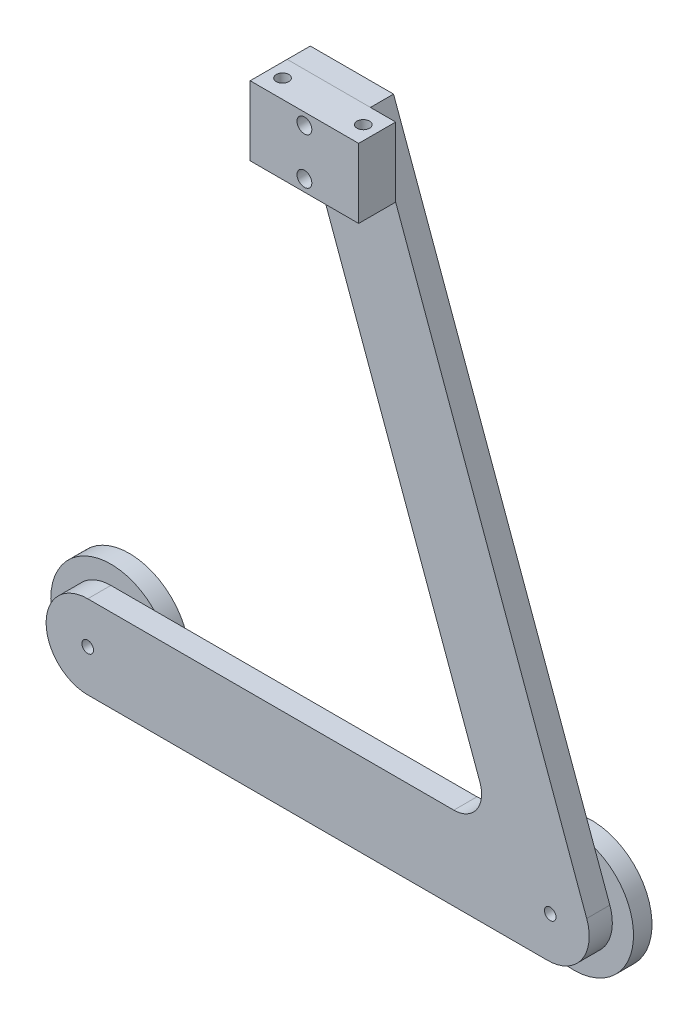
from build123d import *

# Parameters (mm, degrees)
SKETCH_1_R          = 1.25
EXTRUDE_1_DEPTH     = 5
SKETCH_2_W          = 23.459553514
SKETCH_2_H          = 15
EXTRUDE_2_DEPTH     = 8
SKETCH_3_R          = 1.6
CUT_EXTRUDE_1_DEPTH = 157.667782704
SKETCH_4_R          = 1.35
CUT_EXTRUDE_2_DEPTH = 160.025582655
SKETCH_6_R          = 3
SKETCH_6_R_2        = 1.25
EXTRUDE_3_DEPTH     = 5
EXTRUDE_3_2_DEPTH   = 5
SKETCH_7_R          = 13
SKETCH_7_R_2        = 3
EXTRUDE_4_DEPTH     = 4
EXTRUDE_4_2_DEPTH   = 4


with BuildPart() as part:
    # ｽｹｯﾁ1 → ﾎﾞｽ - 押し出し1 (new body)
    with BuildSketch(Plane.XY):
        with BuildLine():
            Line((-44.607087957, 122.55696691), (-2.930732316, 8.05212086))
            ThreePointArc((-2.930732316, 8.05212086), (-3.653975775, 2.558541382), (-8.56888804, 0))
            Line((-8.56888804, 0), (-87.724267892, 0))
            ThreePointArc((-87.724267892, 0), (-94.088228922, -2.636038969), (-96.724267892, -9))
            ThreePointArc((-96.724267892, -9), (-94.088228922, -15.363961031), (-87.724267892, -18))
            Line((-87.724267892, -18), (11.698132156, -18))
            ThreePointArc((11.698132156, -18), (19.070500555, -14.162187927), (20.155365743, -5.92181871))
            Line((20.155365743, -5.92181871), (-26.607087957, 122.55696691))
            Line((-26.607087957, 122.55696691), (-44.607087957, 122.55696691))
        make_face()
        with Locations((12.275732108, -9)):
            Circle(SKETCH_1_R, mode=Mode.SUBTRACT)
        with Locations((-87.724267892, -9)):
            Circle(SKETCH_1_R, mode=Mode.SUBTRACT)
    extrude(amount=EXTRUDE_1_DEPTH)


with BuildPart() as body_2:
    # ｽｹｯﾁ2 → ﾎﾞｽ - 押し出し2 (new body)
    with BuildSketch(Plane.XY.offset(5)):
        with Locations((-32.8773112, 115.05696691)):
            Rectangle(SKETCH_2_W, SKETCH_2_H)
    extrude(amount=EXTRUDE_2_DEPTH)


with BuildPart() as cut_extrude_1_tool:
    # ｽｹｯﾁ3 → ｶｯﾄ - 押し出し1 (new, through all)
    with BuildSketch(Plane.XY.offset(13)):
        with Locations((-32.8773112, 120.05696691)):
            Circle(SKETCH_3_R)
        with Locations((-32.8773112, 110.05696691)):
            Circle(SKETCH_3_R)
    extrude(amount=-CUT_EXTRUDE_1_DEPTH)


with BuildPart() as part_1:
    add(part.part)

    # ｶｯﾄ - 押し出し1: cut by cut_extrude_1_tool
    add(cut_extrude_1_tool.part, mode=Mode.SUBTRACT)


with BuildPart() as body_2_1:
    add(body_2.part)

    # ｶｯﾄ - 押し出し1: cut by cut_extrude_1_tool
    add(cut_extrude_1_tool.part, mode=Mode.SUBTRACT)

    # ｽｹｯﾁ4 → ｶｯﾄ - 押し出し2 (cut, through all)
    with BuildSketch(Plane.XZ.offset(-107.55696691)):
        with Locations(Location((-24.147534443, 9, 0), (0, 0, 270))):
            Circle(SKETCH_4_R)
        with Locations(Location((-41.607087957, 9, 0), (0, 0, 90))):
            Circle(SKETCH_4_R)
    extrude(amount=-CUT_EXTRUDE_2_DEPTH, mode=Mode.SUBTRACT)


with BuildPart() as body_3:
    # ｽｹｯﾁ6 → ﾎﾞｽ - 押し出し3 (new body)
    with BuildSketch(Plane(origin=(0, 0, 0), x_dir=(-1, 0, 0), z_dir=(0, 0, -1))):
        with Locations((-12.275732108, -9)):
            Circle(SKETCH_6_R)
        with Locations((-12.275732108, -9)):
            Circle(SKETCH_6_R_2, mode=Mode.SUBTRACT)
    extrude(amount=EXTRUDE_3_DEPTH)


with BuildPart() as body_4:
    # ｽｹｯﾁ6 → Extrude 3 2 (new body)
    with BuildSketch(Plane(origin=(0, 0, 0), x_dir=(-1, 0, 0), z_dir=(0, 0, -1))):
        with Locations((87.724267892, -9)):
            Circle(SKETCH_6_R)
        with Locations((87.724267892, -9)):
            Circle(SKETCH_6_R_2, mode=Mode.SUBTRACT)
    extrude(amount=EXTRUDE_3_2_DEPTH)


with BuildPart() as body_5:
    # ｽｹｯﾁ7 → ﾎﾞｽ - 押し出し4 (new body)
    with BuildSketch(Plane(origin=(0, 0, 0), x_dir=(-1, 0, 0), z_dir=(0, 0, -1))):
        with Locations((-12.275732108, -9)):
            Circle(SKETCH_7_R)
        with Locations((-12.275732108, -9)):
            Circle(SKETCH_7_R_2, mode=Mode.SUBTRACT)
    extrude(amount=EXTRUDE_4_DEPTH)


with BuildPart() as body_6:
    # ｽｹｯﾁ7 → Extrude 4 2 (new body)
    with BuildSketch(Plane(origin=(0, 0, 0), x_dir=(-1, 0, 0), z_dir=(0, 0, -1))):
        with Locations((87.724267892, -9)):
            Circle(SKETCH_7_R)
        with Locations((87.724267892, -9)):
            Circle(SKETCH_7_R_2, mode=Mode.SUBTRACT)
    extrude(amount=EXTRUDE_4_2_DEPTH)


solid = Compound([part_1.part, body_2_1.part, body_3.part, body_4.part, body_5.part, body_6.part])
